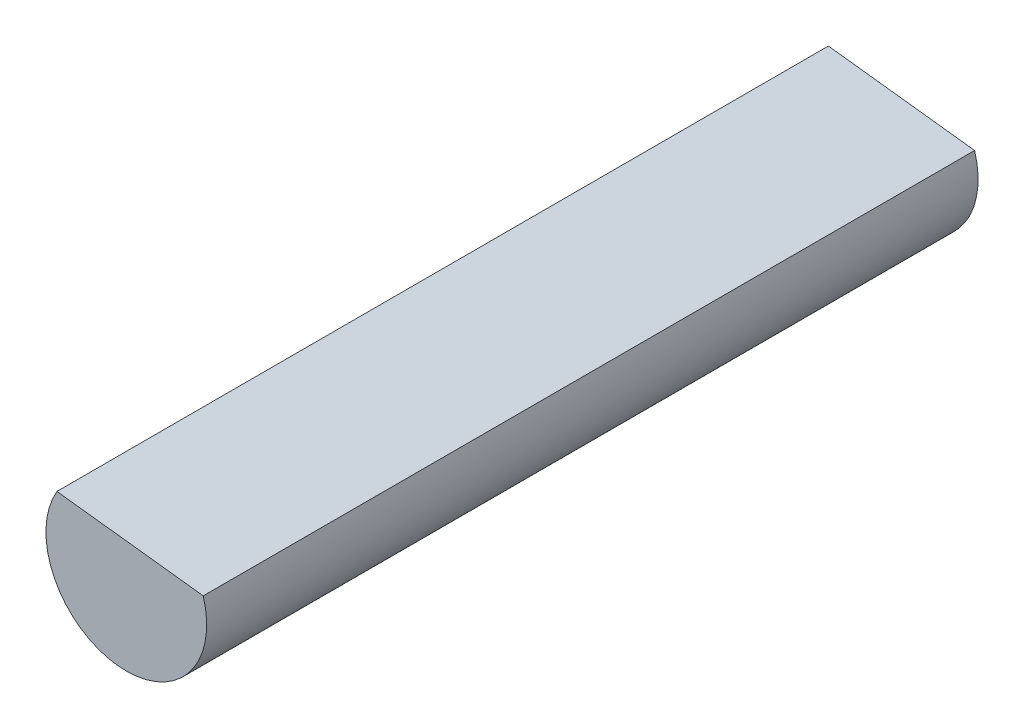
from build123d import *

# Parameters (mm, degrees)
EXTRUDE_1_DEPTH = 48


with BuildPart() as part:
    # 草图1 → 凸台-拉伸1 (new body)
    with BuildSketch(Plane.XY):
        with BuildLine():
            Line((4.785886169, 1.447512893), (-4.315736579, 2.524760935))
            ThreePointArc((-4.315736579, 2.524760935), (-0.587686987, -4.965342285), (4.785886169, 1.447512893))
        make_face()
    extrude(amount=EXTRUDE_1_DEPTH)


solid = part.part
